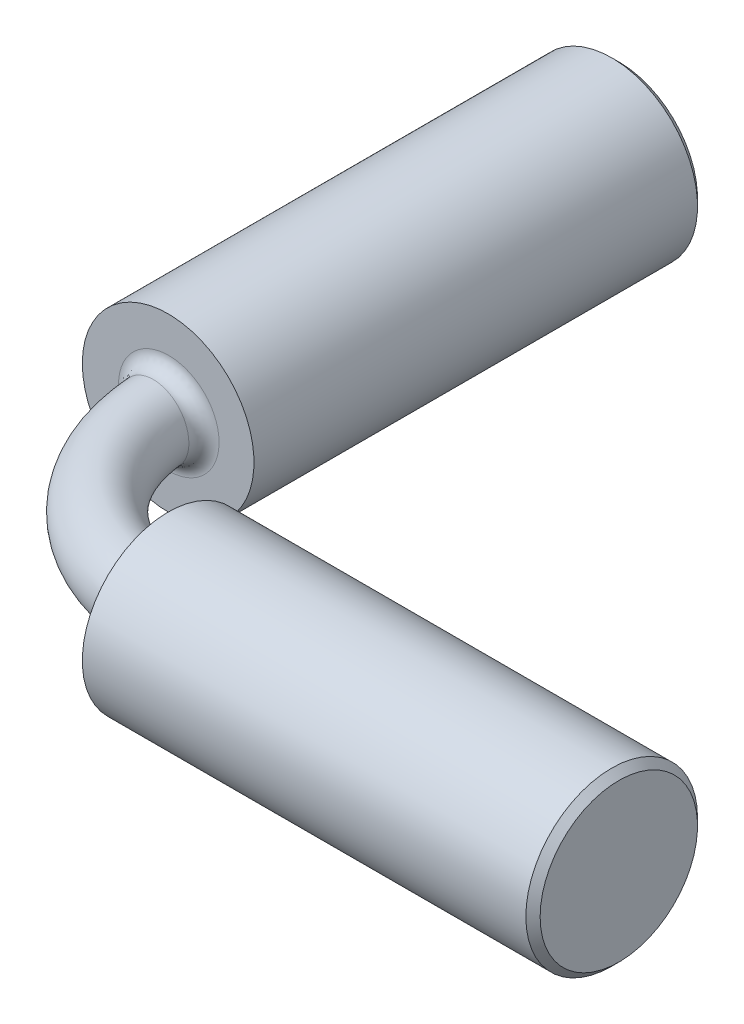
from build123d import *

# Parameters (mm, degrees)
SWEEP2_PROFILE_R     = 2.5
SKETCH49_R           = 6
BOSS_EXTRUDE9_DEPTH  = 31.5
SKETCH54_R           = 6
BOSS_EXTRUDE10_DEPTH = 31.5
FILLET32_R           = 1
FILLET33_R           = 1
CHAMFER1_SIZE        = 0.5
CHAMFER2_SIZE        = 0.5


with BuildPart() as part:
    # Sweep2: sweep along a path in Sketch1
    with BuildLine(Plane(origin=(0, 0, 0), x_dir=(1, 0, 0), z_dir=(0, 1, 0))) as sweep2_path:
        Line((0, 31.5), (0, 0))
        ThreePointArc((0, 0), (3.514718626, -8.485281374), (12, -12))
        Line((12, -12), (43.5, -12))
    # Sweep2 profile (on start of the path) → Sweep2 (sweep)
    with BuildSketch(Plane.XY.offset(-31.5)):
        Circle(SWEEP2_PROFILE_R)
    sweep(path=sweep2_path.line)

    # Sketch49 → Boss-Extrude9 (add)
    with BuildSketch(Plane(origin=(43.5, 0, 0), x_dir=(0, 0, -1), z_dir=(1, 0, 0))):
        with Locations((-12, 0)):
            Circle(SKETCH49_R)
    extrude(amount=-BOSS_EXTRUDE9_DEPTH)

    # Sketch54 → Boss-Extrude10 (add)
    with BuildSketch(Plane(origin=(0, 0, -31.5), x_dir=(-1, 0, 0), z_dir=(0, 0, -1))):
        Circle(SKETCH54_R)
    extrude(amount=-BOSS_EXTRUDE10_DEPTH)

    # Fillet32
    fillet32_edges = [part.edges().sort_by_distance(p)[0] for p in [
        (12, 0, 14.5),
    ]]
    fillet(fillet32_edges, radius=FILLET32_R)

    # Fillet33
    fillet33_edges = [part.edges().sort_by_distance(p)[0] for p in [
        (-2.5, 0, 0),
    ]]
    fillet(fillet33_edges, radius=FILLET33_R)

    # Chamfer1
    chamfer1_edges = [part.edges().sort_by_distance(p)[0] for p in [
        (43.5, 0, 18),
    ]]
    chamfer(chamfer1_edges, length=CHAMFER1_SIZE)

    # Chamfer2
    chamfer2_edges = [part.edges().sort_by_distance(p)[0] for p in [
        (6, 0, -31.5),
    ]]
    chamfer(chamfer2_edges, length=CHAMFER2_SIZE)


solid = part.part
